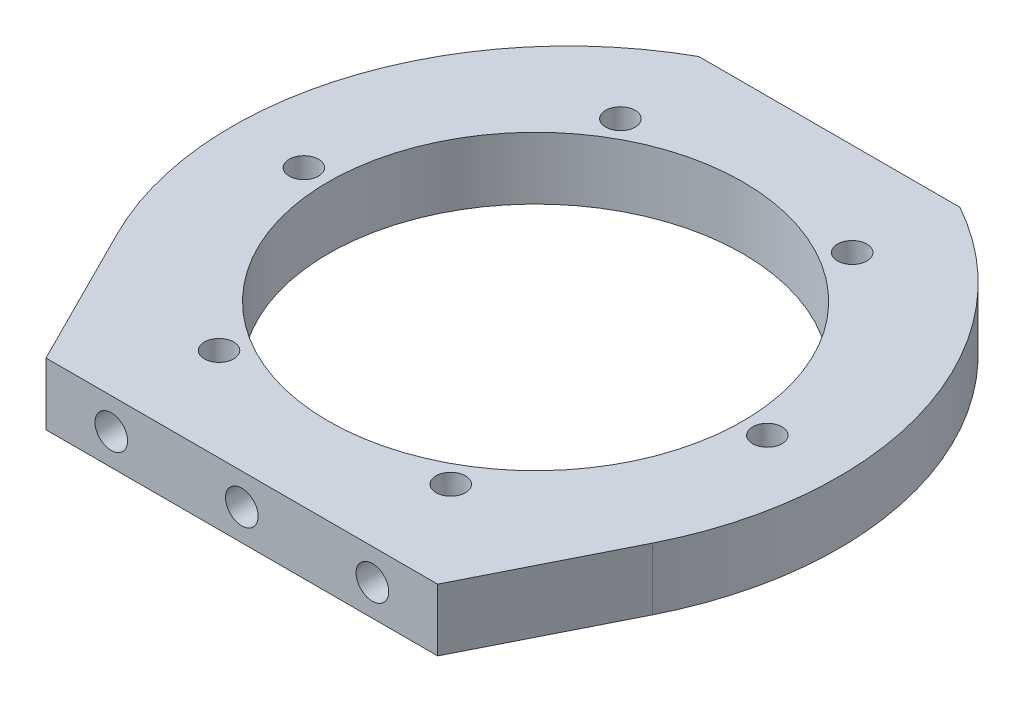
from build123d import *

# Parameters (mm, degrees)
F_3_8INCH_DEPTH    = 4.7625
SKETCH2_R          = 31.75
CUT_EXTRUDE1_DEPTH = 9.525
SKETCH3_R          = 2.25
M4_THROUGH_DEPTH   = 9.525
SKETCH4_R          = 2.5
M5X8_DRILL_DEPTH   = 8
SKETCH5_R          = 2.5
M5X8_DRILL2_DEPTH  = 8


with BuildPart() as part:
    # Sketch1 → 3/8inch (new, symmetric)
    with BuildSketch(Plane(origin=(0, 0, 0), x_dir=(1, 0, 0), z_dir=(0, 1, 0))):
        with BuildLine():
            Line((-30, -45), (30, -45))
            Line((30, -45), (40.997797218, -23.112824386))
            ThreePointArc((40.997797218, -23.112824386), (44.19360745, 15.165387766), (20, 45))
            Line((20, 45), (-20, 45))
            ThreePointArc((-20, 45), (-44.19360745, 15.165387766), (-40.997797218, -23.112824386))
            Line((-40.997797218, -23.112824386), (-30, -45))
        make_face()
    extrude(amount=F_3_8INCH_DEPTH, both=True)

    # Sketch2 → Cut-Extrude1 (cut)
    with BuildSketch(Plane(origin=(0, 4.7625, 0), x_dir=(1, 0, 0), z_dir=(0, 1, 0))):
        with Locations(Location((0, 0, 0), (0, 0, 270))):
            Circle(SKETCH2_R)
    extrude(amount=-CUT_EXTRUDE1_DEPTH, mode=Mode.SUBTRACT)

    # Sketch3 → M4_through (cut)
    with BuildSketch(Plane(origin=(0, 4.7625, 0), x_dir=(1, 0, 0), z_dir=(0, 1, 0))):
        with Locations(Location((17.75, 30.743901834, 0), (0, 0, 270))):
            Circle(SKETCH3_R)
        with Locations(Location((35.5, 0, 0), (0, 0, 270))):
            Circle(SKETCH3_R)
        with Locations(Location((17.75, -30.743901834, 0), (0, 0, 270))):
            Circle(SKETCH3_R)
        with Locations(Location((-17.75, -30.743901834, 0), (0, 0, 270))):
            Circle(SKETCH3_R)
        with Locations(Location((-35.5, 0, 0), (0, 0, 270))):
            Circle(SKETCH3_R)
        with Locations(Location((-17.75, 30.743901834, 0), (0, 0, 270))):
            Circle(SKETCH3_R)
    extrude(amount=-M4_THROUGH_DEPTH, mode=Mode.SUBTRACT)

    # Sketch4 → M5x8_DRILL (cut)
    with BuildSketch(Plane(origin=(0, 0, -45), x_dir=(-1, 0, 0), z_dir=(0, 0, -1))):
        with Locations((-12, 0)):
            Circle(SKETCH4_R)
        with Locations(Location((12, 0, 0), (0, 0, 180))):
            Circle(SKETCH4_R)
    extrude(amount=-M5X8_DRILL_DEPTH, mode=Mode.SUBTRACT)

    # Sketch5 → M5x8_DRILL2 (cut)
    with BuildSketch(Plane.XY.offset(45)):
        with Locations((-20, 0)):
            Circle(SKETCH5_R)
        with Locations(Location((20, 0, 0), (0, 0, 180))):
            Circle(SKETCH5_R)
        Circle(SKETCH5_R)
    extrude(amount=-M5X8_DRILL2_DEPTH, mode=Mode.SUBTRACT)


solid = part.part
